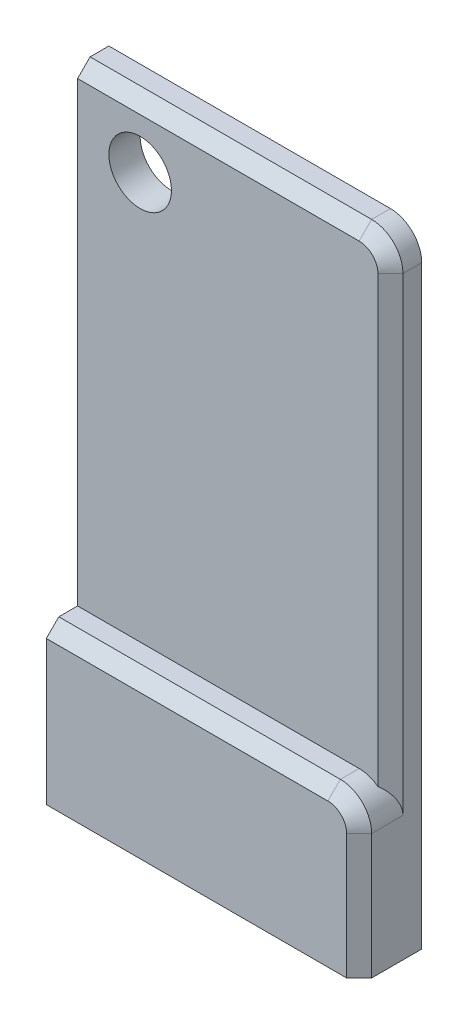
from build123d import *

# Parameters (mm, degrees)
SKETCH1_W           = 500
SKETCH1_H           = 1000
BOSS_EXTRUDE1_DEPTH = 50
SKETCH2_W           = 500
SKETCH2_H           = 250
BOSS_EXTRUDE2_DEPTH = 50
SKETCH3_R           = 50
CUT_EXTRUDE1_DEPTH  = 620.135753799
FILLET1_R           = 50
CHAMFER1_SIZE       = 20
SHELL1_T            = -10


with BuildPart() as part:
    # Sketch1 → Boss-Extrude1 (new body)
    with BuildSketch(Plane.XY):
        with Locations((50, -39.285714286)):
            Rectangle(SKETCH1_W, SKETCH1_H)
    extrude(amount=BOSS_EXTRUDE1_DEPTH)

    # Sketch2 → Boss-Extrude2 (add)
    with BuildSketch(Plane.XY.offset(50)):
        with Locations((50, -414.285714286)):
            Rectangle(SKETCH2_W, SKETCH2_H)
    extrude(amount=BOSS_EXTRUDE2_DEPTH)

    # Sketch3 → Cut-Extrude1 (cut, through all)
    with BuildSketch(Plane.XY.offset(50)):
        with Locations((-100, 360.714285714)):
            Circle(SKETCH3_R)
    extrude(amount=-CUT_EXTRUDE1_DEPTH, mode=Mode.SUBTRACT)

    # Fillet1
    fillet1_edges = [part.edges().sort_by_distance(p)[0] for p in [
        (300, -289.285714286, 75),
        (300, 460.714285714, 25),
    ]]
    fillet(fillet1_edges, radius=FILLET1_R)

    # Chamfer1
    chamfer1_edges = [part.edges().sort_by_distance(p)[0] for p in [
        (300, 35.714285714, 50),
        (300, -439.285714286, 100),
        (25, -289.285714286, 100),
        (285.355339059, -303.930375226, 100),
        (25, 460.714285714, 50),
        (285.355339059, 446.069624774, 50),
    ]]
    chamfer(chamfer1_edges, length=CHAMFER1_SIZE)

    # Shell1
    shell1_openings = [part.faces().sort_by_distance(p)[0] for p in [
        (52.135766221, -46.209610097, 0),
        (49.022757697, -539.285714286, 49.825970549),
        (-200, -115.53101756, 34.785292539),
    ]]
    offset(amount=SHELL1_T, openings=shell1_openings, kind=Kind.INTERSECTION)


solid = part.part
